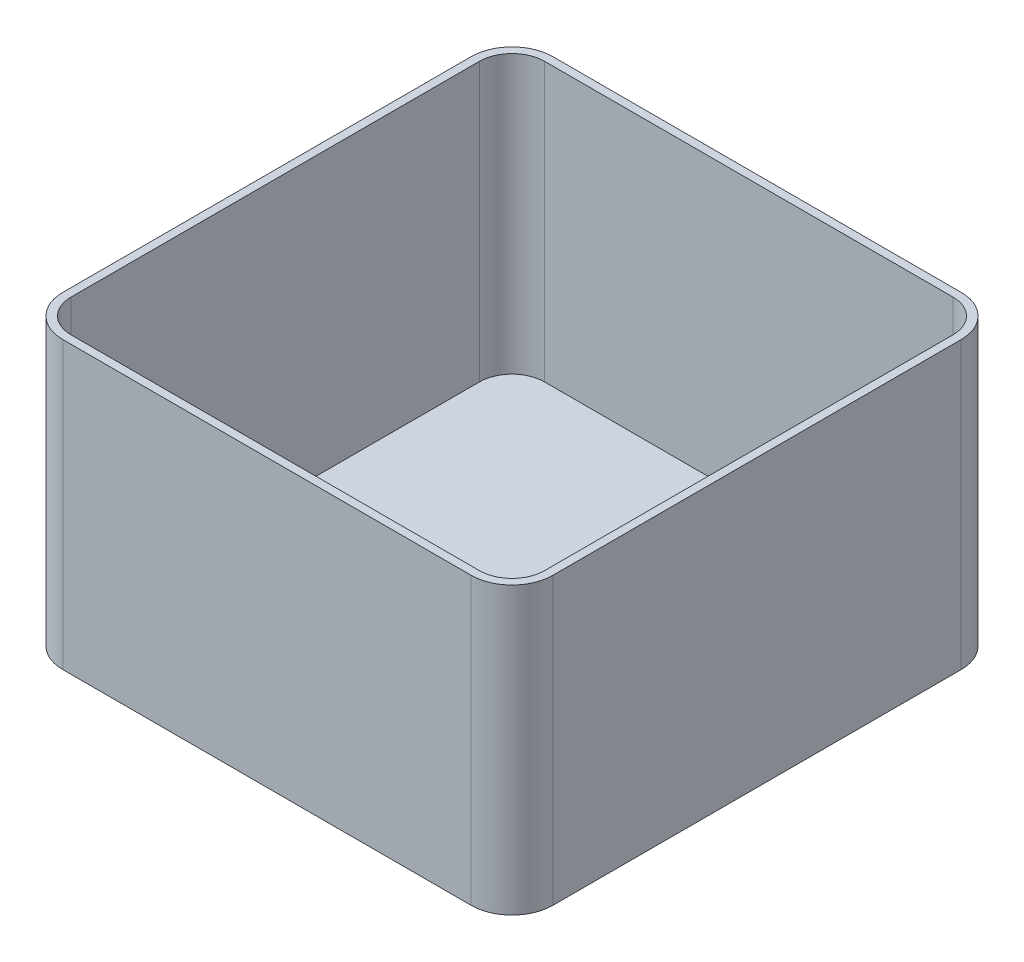
from build123d import *

# Parameters (mm, degrees)
BOSS_EXTRUDE1_DEPTH = 35
SHELL1_T            = -1


with BuildPart() as part:
    # Sketch1 → Boss-Extrude1 (new body)
    with BuildSketch(Plane(origin=(0, 0, 0), x_dir=(1, 0, 0), z_dir=(0, 1, 0))):
        with BuildLine():
            Line((-25, -30), (25, -30))
            ThreePointArc((25, -30), (28.535533906, -28.535533906), (30, -25))
            Line((30, -25), (30, 25))
            ThreePointArc((30, 25), (28.535533906, 28.535533906), (25, 30))
            Line((25, 30), (-25, 30))
            ThreePointArc((-25, 30), (-28.535533906, 28.535533906), (-30, 25))
            Line((-30, 25), (-30, -25))
            ThreePointArc((-30, -25), (-28.535533906, -28.535533906), (-25, -30))
        make_face()
    extrude(amount=BOSS_EXTRUDE1_DEPTH)

    # Shell1
    shell1_openings = [part.faces().sort_by_distance(p)[0] for p in [
        (0, 35, 0),
    ]]
    offset(amount=SHELL1_T, openings=shell1_openings, kind=Kind.INTERSECTION)


solid = part.part
